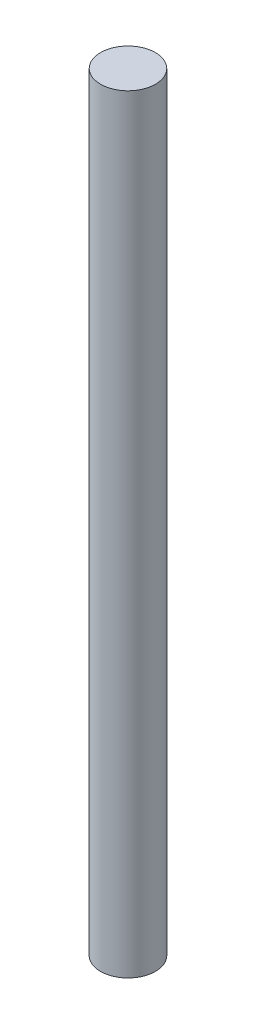
from build123d import *

# Parameters (mm, degrees)
SKETCH1_R           = 5
BOSS_EXTRUDE1_DEPTH = 140


with BuildPart() as part:
    # Sketch1 → Boss-Extrude1 (new body)
    with BuildSketch(Plane(origin=(0, 0, 0), x_dir=(1, 0, 0), z_dir=(0, 1, 0))):
        with Locations(Location((0, 0, 0), (0, 0, 270))):
            Circle(SKETCH1_R)
    extrude(amount=BOSS_EXTRUDE1_DEPTH)


solid = part.part
